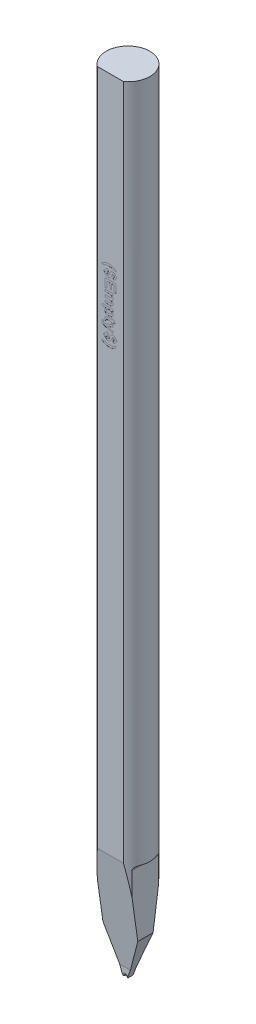
from build123d import *

# Parameters (mm, degrees)
SKETCH_TL_CUTTING_R       = 1.99771
TL_CUTTING_DEPTH          = 72.009
SKETCH_TDF_GRINDING_W     = 4.01542
SKETCH_TDF_GRINDING_H     = 4.01542
TDF_GRINDING_DEPTH        = 73.064400167
ENGRAVING_DEPTH           = 0.005
VW_VR_GRINDING_DEPTH      = 2.00771
VW_VR_GRINDING_DEPTH_BACK = 2.00771
ISA_GRINDING_DEPTH        = 2.00771
ISA_GRINDING_DEPTH_BACK   = 2.00771
PRE_FRX_BRX_DEPTH         = 2.00771
PRE_FRX_BRX_DEPTH_BACK    = 2.00771
SKETCH_PRE_FRX_BRX_W      = 1.7372
SKETCH_PRE_FRX_BRX_H      = 0.78994
FR_EDM_R                  = 0.20066
BR_EDM_R                  = 0.09906
FA_BA_GRINDING_DEPTH      = 2.00771
FA_BA_GRINDING_DEPTH_BACK = 2.00771


with BuildPart() as part:
    # sketch_TL_cutting → TL_cutting (new body)
    with BuildSketch(Plane(origin=(0, 0, 0), x_dir=(1, 0, 0), z_dir=(0, 1, 0))):
        with Locations(Location((0, 0, 0), (0, 0, 270))):
            Circle(SKETCH_TL_CUTTING_R)
    extrude(amount=TL_CUTTING_DEPTH)

    # sketch_TDF_grinding → TDF_grinding (cut, through all)
    with BuildSketch(Plane(origin=(0, 0, 0), x_dir=(1, 0, 0), z_dir=(0, 1, 0))):
        with Locations((0, -3.60918)):
            Rectangle(SKETCH_TDF_GRINDING_W, SKETCH_TDF_GRINDING_H)
    extrude(amount=TDF_GRINDING_DEPTH, mode=Mode.SUBTRACT)

    # sketch_engraving → engraving (cut)
    # profile 1 of 9: a face of its own
    with BuildSketch(Plane.XY.offset(1.60147)):
        with BuildLine():
            Line((-0.769230769, 56.611564103), (-0.769230769, 56.726948718))
            add(Edge.make_bspline(
                [(-0.769230769, 56.726948718), (-0.75654381, 56.735663826), (-0.731271202, 56.75302445), (-0.692407522, 56.777108744), (-0.653253405, 56.799807931), (-0.61390654, 56.821057444), (-0.574088198, 56.840594152), (-0.533834647, 56.85827299), (-0.493399806, 56.874882514), (-0.452559629, 56.889379278), (-0.411730957, 56.902372472), (-0.37117072, 56.913933672), (-0.330720232, 56.923167297), (-0.290776237, 56.931412038), (-0.251027852, 56.937272807), (-0.211754164, 56.941765375), (-0.172781576, 56.944468765), (-0.146905785, 56.944754889), (-0.134014423, 56.944897436)],
                knots=[0, 0, 0, 0, 1.083507766, 2.158363427, 3.217863588, 4.26952313, 5.306027247, 6.339424422, 7.364296331, 8.382863073, 9.389381803, 10.380601174, 11.351000725, 12.30983044, 13.25126181, 14.178453692, 15.092502614, 16, 16, 16, 16], degree=3))
            add(Edge.make_bspline(
                [(-0.134014423, 56.944897436), (-0.118183889, 56.944720886), (-0.086756823, 56.944370396), (-0.039956705, 56.941072127), (0.006211299, 56.935593151), (0.051774559, 56.928331702), (0.096653064, 56.918551161), (0.140935004, 56.90698945), (0.184649405, 56.893283306), (0.2131297, 56.882285182), (0.227363782, 56.876788462)],
                knots=[0, 0, 0, 0, 1.026825403, 2.038472649, 3.041589395, 4.042121555, 5.030199178, 6.019908545, 7.010375948, 8, 8, 8, 8], degree=3))
            add(Edge.make_bspline(
                [(0.227363782, 56.876788462), (0.251683724, 56.86662748), (0.300012726, 56.846435406), (0.369571494, 56.810574678), (0.43660795, 56.771337941), (0.478889333, 56.74173111), (0.5, 56.726948718)],
                knots=[0, 0, 0, 0, 1.013799707, 2.014640032, 3.00872983, 4, 4, 4, 4], degree=3))
            Line((0.5, 56.726948718), (0.5, 56.611564103))
            add(Edge.make_bspline(
                [(0.5, 56.611564103), (0.483671183, 56.618120598), (0.451734259, 56.630944202), (0.404403907, 56.648404634), (0.359131946, 56.664765299), (0.315658143, 56.679413628), (0.273946214, 56.69238068), (0.234213299, 56.70413527), (0.196217088, 56.713881677), (0.148045143, 56.725244778), (0.087918925, 56.736328711), (0.014547585, 56.745586625), (-0.060927268, 56.751701265), (-0.111967077, 56.752291015), (-0.137820513, 56.752589744)],
                knots=[0, 0, 0, 0, 0.962863393, 1.883228553, 2.76049045, 3.597092273, 4.393389301, 5.150807945, 5.864262675, 6.539665604, 7.859093728, 9.207470704, 10.585486956, 12, 12, 12, 12], degree=3))
            add(Edge.make_bspline(
                [(-0.137820513, 56.752589744), (-0.155988322, 56.752343487), (-0.192554908, 56.751847842), (-0.247746387, 56.748261408), (-0.303631191, 56.742771672), (-0.359778417, 56.734616456), (-0.415599441, 56.724983778), (-0.470281715, 56.713252997), (-0.523675907, 56.700229417), (-0.558467126, 56.689835667), (-0.575721154, 56.68468109)],
                knots=[0, 0, 0, 0, 0.980476084, 1.97341699, 2.983932057, 4.010380506, 5.034783484, 6.040583597, 7.02826557, 8, 8, 8, 8], degree=3))
            add(Edge.make_bspline(
                [(-0.575721154, 56.68468109), (-0.581680072, 56.682859776), (-0.594203733, 56.679031979), (-0.613643056, 56.671976075), (-0.635084462, 56.664505083), (-0.658352199, 56.655786341), (-0.683499135, 56.646272512), (-0.710430496, 56.635536673), (-0.739235975, 56.623981317), (-0.7590223, 56.615790194), (-0.769230769, 56.611564103)],
                knots=[0, 0, 0, 0, 0.722569934, 1.518601428, 2.397973139, 3.356076064, 4.400297102, 5.516290093, 6.718565658, 8, 8, 8, 8], degree=3))
        make_face()
    # profile 2 of 9: a face of its own
    with BuildSketch(Plane.XY.offset(1.60147)):
        with BuildLine():
            Line((-0.346153846, 56.226948718), (-0.063902244, 56.226948718))
            add(Edge.make_bspline(
                [(-0.063902244, 56.226948718), (-0.060691422, 56.237143266), (-0.054417647, 56.257062868), (-0.043102981, 56.285435864), (-0.03104034, 56.311894737), (-0.017255553, 56.335922913), (-0.002706808, 56.358195401), (0.013349437, 56.378160446), (0.030392388, 56.396185381), (0.048816212, 56.411900426), (0.068263793, 56.425644345), (0.088567069, 56.437911105), (0.110125164, 56.447723618), (0.132438861, 56.456389102), (0.155973296, 56.462652823), (0.180398952, 56.467325467), (0.205875491, 56.469883399), (0.223151848, 56.470317076), (0.231971154, 56.470538462)],
                knots=[0, 0, 0, 0, 1.233471439, 2.410137288, 3.52407584, 4.58730311, 5.604983541, 6.592165279, 7.540854934, 8.464761394, 9.382375568, 10.287963167, 11.198393515, 12.113251355, 13.048281916, 14.005296989, 14.981735836, 16, 16, 16, 16], degree=3))
            add(Edge.make_bspline(
                [(0.231971154, 56.470538462), (0.240862374, 56.470369834), (0.258371063, 56.47003777), (0.284035262, 56.466710465), (0.308630388, 56.461512705), (0.332214124, 56.454327878), (0.354666156, 56.444872426), (0.375999861, 56.433410852), (0.396225213, 56.419891645), (0.415061575, 56.404246572), (0.432812136, 56.387237259), (0.448139285, 56.36818408), (0.461933462, 56.348127842), (0.473588781, 56.326562978), (0.483166571, 56.303572929), (0.491049568, 56.279359162), (0.496663149, 56.253639945), (0.49887037, 56.235984548), (0.5, 56.226948718)],
                knots=[0, 0, 0, 0, 1.065419917, 2.098036635, 3.096580821, 4.076501369, 5.04880669, 6.012240184, 6.975806694, 7.959773282, 8.944748783, 9.917449457, 10.885494533, 11.859775015, 12.849941464, 13.867618658, 14.908671599, 16, 16, 16, 16], degree=3))
            Line((0.5, 56.226948718), (0.576923077, 56.226948718))
            Line((0.576923077, 56.226948718), (0.576923077, 56.124384615))
            Line((0.576923077, 56.124384615), (0.5, 56.124384615))
            add(Edge.make_bspline(
                [(0.5, 56.124384615), (0.498841424, 56.115486686), (0.496573389, 56.09806805), (0.49137632, 56.072741064), (0.484539762, 56.048860422), (0.476339583, 56.026349842), (0.466697028, 56.005143702), (0.455518194, 55.985361964), (0.442840864, 55.966933141), (0.428527318, 55.95018479), (0.413145824, 55.934584638), (0.39610941, 55.920827789), (0.378155721, 55.908112331), (0.358829355, 55.897061433), (0.338178987, 55.887674614), (0.316411919, 55.87941047), (0.293274546, 55.872799442), (0.27733531, 55.869600771), (0.269230769, 55.867974359)],
                knots=[0, 0, 0, 0, 1.151887312, 2.254940947, 3.31604567, 4.338626222, 5.328478017, 6.30366564, 7.252607131, 8.195603958, 9.129238937, 10.061258459, 11.003163313, 11.951756149, 12.914654824, 13.913120779, 14.938895277, 16, 16, 16, 16], degree=3))
            Line((0.269230769, 55.867974359), (0.243589744, 56.034641026))
            add(Edge.make_bspline(
                [(0.243589744, 56.034641026), (0.250446456, 56.036643558), (0.263771485, 56.040535192), (0.282535036, 56.048465441), (0.299671316, 56.057678859), (0.315110354, 56.068227628), (0.328747964, 56.080224188), (0.340615646, 56.09355588), (0.351026936, 56.108191319), (0.356312409, 56.118960751), (0.358974359, 56.124384615)],
                knots=[0, 0, 0, 0, 1.132612369, 2.201068414, 3.225051706, 4.215432487, 5.161289188, 6.099220658, 7.04270083, 8, 8, 8, 8], degree=3))
            Line((0.358974359, 56.124384615), (0.095552885, 56.124384615))
            add(Edge.make_bspline(
                [(0.095552885, 56.124384615), (0.091846888, 56.111134392), (0.084711092, 56.085621445), (0.072793936, 56.049230821), (0.059721416, 56.016296736), (0.046029912, 55.986577051), (0.031359337, 55.960199095), (0.016057305, 55.936950063), (-0.000406851, 55.917264806), (-0.017692985, 55.90057685), (-0.036309981, 55.887032312), (-0.055531671, 55.874731893), (-0.076319964, 55.864821076), (-0.098285192, 55.856514134), (-0.121510852, 55.850207549), (-0.145938277, 55.845497559), (-0.171622588, 55.842996815), (-0.189164574, 55.842557523), (-0.198116987, 55.842333333)],
                knots=[0, 0, 0, 0, 1.47567488, 2.841372022, 4.104837161, 5.274356171, 6.348422789, 7.339634063, 8.254806618, 9.095728451, 9.909336987, 10.720135121, 11.540149133, 12.374211184, 13.236039526, 14.118162803, 15.039619326, 16, 16, 16, 16], degree=3))
            add(Edge.make_bspline(
                [(-0.198116987, 55.842333333), (-0.208142, 55.842575379), (-0.227850116, 55.843051216), (-0.256821167, 55.846471811), (-0.284551423, 55.852320659), (-0.311143037, 55.860302461), (-0.336478096, 55.870703856), (-0.360449465, 55.883721867), (-0.383339011, 55.898751156), (-0.405018236, 55.915957227), (-0.425053345, 55.935437905), (-0.443316442, 55.956889482), (-0.459578741, 55.980293772), (-0.474036034, 56.005432354), (-0.486703174, 56.032431862), (-0.497491454, 56.061298177), (-0.506369109, 56.092117722), (-0.510637243, 56.113464927), (-0.512820513, 56.124384615)],
                knots=[0, 0, 0, 0, 1.03830894, 2.041205585, 3.016534218, 3.970513834, 4.913295289, 5.847846025, 6.791667113, 7.746548932, 8.710133323, 9.681653264, 10.66021374, 11.657945465, 12.682082278, 13.745789509, 14.84690868, 16, 16, 16, 16], degree=3))
            Line((-0.512820513, 56.124384615), (-0.641025641, 56.124384615))
            Line((-0.641025641, 56.124384615), (-0.641025641, 56.226948718))
            Line((-0.641025641, 56.226948718), (-0.512820513, 56.226948718))
            add(Edge.make_bspline(
                [(-0.512820513, 56.226948718), (-0.511365569, 56.235993376), (-0.508497729, 56.253821301), (-0.501708114, 56.279680106), (-0.493672179, 56.304444222), (-0.483362821, 56.327734513), (-0.471282985, 56.349710338), (-0.457442831, 56.370330001), (-0.441914521, 56.389778959), (-0.424444795, 56.407782199), (-0.405185733, 56.424467381), (-0.384010208, 56.4395823), (-0.360904849, 56.452986013), (-0.335919458, 56.464741317), (-0.309230571, 56.475320078), (-0.280464835, 56.483703551), (-0.249946988, 56.491100501), (-0.228795072, 56.494457879), (-0.217948718, 56.496179487)],
                knots=[0, 0, 0, 0, 1.014565868, 1.999810643, 2.959153021, 3.896762473, 4.817401281, 5.734733625, 6.645326844, 7.571538865, 8.510548692, 9.465314575, 10.450114695, 11.466190414, 12.522838407, 13.627737783, 14.783543095, 16, 16, 16, 16], degree=3))
            Line((-0.217948718, 56.496179487), (-0.192307692, 56.329512821))
            add(Edge.make_bspline(
                [(-0.192307692, 56.329512821), (-0.201304383, 56.327560775), (-0.218871734, 56.323749123), (-0.243936875, 56.315017324), (-0.267070938, 56.304026951), (-0.287973212, 56.290797737), (-0.306574231, 56.276291657), (-0.322506138, 56.260740348), (-0.336055086, 56.244580368), (-0.342841228, 56.232732292), (-0.346153846, 56.226948718)],
                knots=[0, 0, 0, 0, 1.156277083, 2.257799727, 3.327693098, 4.368586128, 5.360870913, 6.286760294, 7.163691387, 8, 8, 8, 8], degree=3))
        make_face()
        with BuildLine():
            add(Edge.make_bspline(
                [(0.358974359, 56.226948718), (0.356717333, 56.232992086), (0.352323078, 56.244758059), (0.342207363, 56.260507034), (0.329671684, 56.273923048), (0.314627801, 56.284702628), (0.298154817, 56.293142912), (0.280699719, 56.299552483), (0.262303768, 56.303185993), (0.249748228, 56.303641235), (0.243389423, 56.303871795)],
                knots=[0, 0, 0, 0, 1.038261919, 2.021415961, 2.996868165, 3.983674221, 4.990617688, 5.975363788, 6.97461459, 8, 8, 8, 8], degree=3))
            add(Edge.make_bspline(
                [(0.243389423, 56.303871795), (0.23756032, 56.303721402), (0.225998475, 56.303423102), (0.209074665, 56.29974233), (0.192634157, 56.29441819), (0.177010257, 56.286573685), (0.16226258, 56.276278866), (0.149112783, 56.262726829), (0.137430451, 56.24612493), (0.131236645, 56.233523802), (0.128004808, 56.226948718)],
                knots=[0, 0, 0, 0, 0.946787839, 1.877924175, 2.805567745, 3.753041052, 4.711661487, 5.718097864, 6.809336945, 8, 8, 8, 8], degree=3))
            Line((0.128004808, 56.226948718), (0.358974359, 56.226948718))
        make_face(mode=Mode.SUBTRACT)
        with BuildLine():
            add(Edge.make_bspline(
                [(-0.346153846, 56.124384615), (-0.345705345, 56.116185175), (-0.34483103, 56.100201084), (-0.337601638, 56.077493624), (-0.325657788, 56.057310262), (-0.309263795, 56.040179958), (-0.289891882, 56.026342959), (-0.268342869, 56.016345675), (-0.24520997, 56.010077578), (-0.229139944, 56.009363677), (-0.220953526, 56.009)],
                knots=[0, 0, 0, 0, 1.03495557, 2.017555319, 2.978963058, 3.976357979, 4.993109917, 5.971347703, 6.966560647, 8, 8, 8, 8], degree=3))
            add(Edge.make_bspline(
                [(-0.220953526, 56.009), (-0.213643973, 56.009272343), (-0.199375663, 56.00980396), (-0.178751062, 56.015029744), (-0.159765904, 56.023484931), (-0.142238273, 56.03538561), (-0.126537208, 56.051348938), (-0.113258624, 56.071844849), (-0.101443075, 56.096373029), (-0.09589405, 56.114671881), (-0.092948718, 56.124384615)],
                knots=[0, 0, 0, 0, 0.934982296, 1.825093612, 2.705865091, 3.586179448, 4.523819282, 5.553563867, 6.701471314, 8, 8, 8, 8], degree=3))
            Line((-0.092948718, 56.124384615), (-0.346153846, 56.124384615))
        make_face(mode=Mode.SUBTRACT)
    # profile 3 of 9: a face of its own
    with BuildSketch(Plane.XY.offset(1.60147)):
        Polygon((-0.5, 55.675666667), (0.5, 55.675666667), (0.5, 54.932076923), (0.333333333, 54.932076923), (0.333333333, 55.483358974), (0.115384615, 55.483358974), (0.115384615, 54.970538462), (-0.051282051, 54.970538462), (-0.051282051, 55.483358974), (-0.333333333, 55.483358974), (-0.333333333, 54.91925641), (-0.5, 54.91925641), align=None)
    # profile 4 of 9: a face of its own
    with BuildSketch(Plane.XY.offset(1.60147)):
        with BuildLine():
            Line((0.230769231, 54.778230769), (0.230769231, 54.585923077))
            Line((0.230769231, 54.585923077), (0.1328125, 54.585923077))
            add(Edge.make_bspline(
                [(0.1328125, 54.585923077), (0.141664699, 54.578359049), (0.158931351, 54.563605038), (0.181382685, 54.538923789), (0.200586186, 54.513416739), (0.21644089, 54.486832809), (0.228531159, 54.458934117), (0.237134296, 54.429946875), (0.242539521, 54.399891949), (0.243237377, 54.379481895), (0.243589744, 54.369176282)],
                knots=[0, 0, 0, 0, 1.107940857, 2.161093632, 3.169644562, 4.144639019, 5.101548547, 6.057210626, 7.019030711, 8, 8, 8, 8], degree=3))
            add(Edge.make_bspline(
                [(0.243589744, 54.369176282), (0.243215794, 54.358410033), (0.242486901, 54.337424744), (0.237632212, 54.306967189), (0.228624904, 54.278890488), (0.216596826, 54.25293503), (0.200997643, 54.229186923), (0.181697421, 54.207803483), (0.1589088, 54.188570942), (0.141647297, 54.178047815), (0.1328125, 54.172661859)],
                knots=[0, 0, 0, 0, 1.087442074, 2.119613481, 3.102840357, 4.056171906, 5.000733146, 5.960649063, 6.95621775, 8, 8, 8, 8], degree=3))
            add(Edge.make_bspline(
                [(0.1328125, 54.172661859), (0.141648331, 54.164741809), (0.15890459, 54.149274061), (0.18160607, 54.123912536), (0.200837622, 54.097588586), (0.216342266, 54.070185607), (0.228440547, 54.041886572), (0.237463475, 54.012736515), (0.242455792, 53.982395313), (0.243209151, 53.961874823), (0.243589744, 53.951508013)],
                knots=[0, 0, 0, 0, 1.113355786, 2.174368662, 3.188819075, 4.168565139, 5.12342631, 6.073356391, 7.026672896, 8, 8, 8, 8], degree=3))
            add(Edge.make_bspline(
                [(0.243589744, 53.951508013), (0.243253707, 53.938725949), (0.242603687, 53.914000698), (0.236233833, 53.878451934), (0.226092646, 53.845846208), (0.211825029, 53.816371427), (0.193628332, 53.79007465), (0.171312748, 53.767536921), (0.145297956, 53.748199279), (0.125650654, 53.738783721), (0.115584936, 53.733959936)],
                knots=[0, 0, 0, 0, 1.140905914, 2.206935121, 3.214358517, 4.182792527, 5.121068659, 6.057503675, 7.004819049, 8, 8, 8, 8], degree=3))
            add(Edge.make_bspline(
                [(0.115584936, 53.733959936), (0.1114006, 53.732358143), (0.102614163, 53.728994633), (0.088193677, 53.7250406), (0.07205936, 53.721717836), (0.05407705, 53.718900231), (0.034354022, 53.716783997), (0.012779717, 53.715109993), (-0.010546601, 53.714459858), (-0.026709385, 53.714241149), (-0.03505609, 53.714128205)],
                knots=[0, 0, 0, 0, 0.70348757, 1.477211565, 2.345356006, 3.290383569, 4.335215205, 5.460703428, 6.68866909, 8, 8, 8, 8], degree=3))
            Line((-0.03505609, 53.714128205), (-0.5, 53.714128205))
            Line((-0.5, 53.714128205), (-0.5, 53.906435897))
            Line((-0.5, 53.906435897), (-0.080128205, 53.906435897))
            add(Edge.make_bspline(
                [(-0.080128205, 53.906435897), (-0.07144761, 53.906547935), (-0.054817384, 53.906762576), (-0.031090468, 53.907406731), (-0.009777274, 53.909044643), (0.009076857, 53.911186366), (0.025551617, 53.91391905), (0.039613136, 53.917295096), (0.051411557, 53.921089266), (0.058064109, 53.924645803), (0.061097756, 53.926267628)],
                knots=[0, 0, 0, 0, 1.448583407, 2.775186282, 3.959557885, 5.014017743, 5.940851432, 6.743435621, 7.42699079, 8, 8, 8, 8], degree=3))
            add(Edge.make_bspline(
                [(0.061097756, 53.926267628), (0.0644449, 53.928508242), (0.071015994, 53.932907002), (0.079428524, 53.94104351), (0.086594396, 53.949987573), (0.092366124, 53.959872082), (0.097066603, 53.970530677), (0.100204228, 53.982148841), (0.10230955, 53.994633517), (0.102477414, 54.003314837), (0.102564103, 54.007798077)],
                knots=[0, 0, 0, 0, 1.007330723, 1.977586358, 2.91811154, 3.870610884, 4.837109745, 5.827490497, 6.87806446, 8, 8, 8, 8], degree=3))
            add(Edge.make_bspline(
                [(0.102564103, 54.007798077), (0.102240034, 54.01443365), (0.101593875, 54.027664313), (0.09685111, 54.047122239), (0.088810593, 54.065848966), (0.077873982, 54.083699946), (0.064089543, 54.100338814), (0.046951113, 54.114414723), (0.027058253, 54.126184107), (0.008201325, 54.133566057), (-0.008714124, 54.138275058), (-0.023370098, 54.141428886), (-0.039736185, 54.144230026), (-0.057919723, 54.146426211), (-0.07777632, 54.14791842), (-0.09941442, 54.149127695), (-0.122723067, 54.149973668), (-0.138888099, 54.150007942), (-0.147235577, 54.150025641)],
                knots=[0, 0, 0, 0, 0.980909897, 1.955835539, 2.942693402, 3.98436442, 5.042755257, 6.12263035, 7.247279534, 8.448501813, 9.105087946, 9.843148781, 10.66469806, 11.560151265, 12.550905382, 13.609296218, 14.765461946, 16, 16, 16, 16], degree=3))
            Line((-0.147235577, 54.150025641), (-0.5, 54.150025641))
            Line((-0.5, 54.150025641), (-0.5, 54.342333333))
            Line((-0.5, 54.342333333), (-0.097355769, 54.342333333))
            add(Edge.make_bspline(
                [(-0.097355769, 54.342333333), (-0.088808683, 54.342387673), (-0.072514885, 54.342491264), (-0.049272866, 54.342832415), (-0.028431625, 54.343598963), (-0.010001412, 54.344816338), (0.006094573, 54.346219335), (0.019817647, 54.347693711), (0.031211059, 54.3496468), (0.042972639, 54.352762901), (0.055281064, 54.357674574), (0.068015353, 54.364905367), (0.078952496, 54.37337508), (0.087734398, 54.383592499), (0.094431133, 54.39552783), (0.099289836, 54.409190268), (0.101996826, 54.424759663), (0.102369061, 54.435739069), (0.102564103, 54.441491987)],
                knots=[0, 0, 0, 0, 1.59941463, 3.049055322, 4.349500855, 5.501487129, 6.504910079, 7.372843676, 8.083634967, 8.665560774, 9.647038445, 10.55368294, 11.398647399, 12.222657519, 13.056461931, 13.945719492, 14.92361148, 16, 16, 16, 16], degree=3))
            add(Edge.make_bspline(
                [(0.102564103, 54.441491987), (0.102234348, 54.448658367), (0.101586917, 54.462728621), (0.097099356, 54.483322194), (0.089385598, 54.502697199), (0.078745529, 54.520760574), (0.065308531, 54.537164364), (0.048811546, 54.551063128), (0.02977557, 54.562600394), (0.011740073, 54.569890429), (-0.004479026, 54.57462018), (-0.018770373, 54.57751101), (-0.034874654, 54.580111233), (-0.052844538, 54.58232052), (-0.072766981, 54.583839446), (-0.094540599, 54.585014918), (-0.118182385, 54.585875318), (-0.134547779, 54.585906775), (-0.143028846, 54.585923077)],
                knots=[0, 0, 0, 0, 1.061105177, 2.08334182, 3.104381884, 4.137278018, 5.176827868, 6.229094397, 7.316239487, 8.460364206, 9.09881589, 9.816452537, 10.617971519, 11.514628853, 12.496857794, 13.576419947, 14.74402393, 16, 16, 16, 16], degree=3))
            Line((-0.143028846, 54.585923077), (-0.5, 54.585923077))
            Line((-0.5, 54.585923077), (-0.5, 54.778230769))
            Line((-0.5, 54.778230769), (0.230769231, 54.778230769))
        make_face()
    # profile 5 of 9: a face of its own
    with BuildSketch(Plane.XY.offset(1.60147)):
        with BuildLine():
            Line((0.230769231, 53.521820513), (0.230769231, 53.329512821))
            Line((0.230769231, 53.329512821), (0.125400641, 53.329512821))
            add(Edge.make_bspline(
                [(0.125400641, 53.329512821), (0.134110558, 53.323789731), (0.151482958, 53.312374718), (0.174623276, 53.291319889), (0.194727471, 53.267179744), (0.21216262, 53.240640955), (0.226252501, 53.211806915), (0.236247247, 53.181133514), (0.242498657, 53.148943396), (0.243222023, 53.126950728), (0.243589744, 53.115770833)],
                knots=[0, 0, 0, 0, 0.978547196, 1.95176541, 2.927409496, 3.924956672, 4.929940552, 5.934297003, 6.949907262, 8, 8, 8, 8], degree=3))
            add(Edge.make_bspline(
                [(0.243589744, 53.115770833), (0.243275199, 53.106003359), (0.242653327, 53.086692556), (0.237904657, 53.058336182), (0.230300531, 53.031019066), (0.219424348, 53.00483804), (0.205256392, 52.979900966), (0.188112758, 52.956138662), (0.167850875, 52.933577666), (0.144791975, 52.912281795), (0.118886648, 52.892784547), (0.090438984, 52.875746955), (0.059420431, 52.861512172), (0.02614289, 52.849614093), (-0.00973483, 52.840790018), (-0.047865347, 52.834089032), (-0.088468702, 52.830383122), (-0.116312431, 52.82980808), (-0.130608974, 52.829512821)],
                knots=[0, 0, 0, 0, 0.889183518, 1.757962001, 2.610823862, 3.466866804, 4.332788647, 5.217155532, 6.130223362, 7.089913047, 8.071415563, 9.077827182, 10.103546864, 11.174887114, 12.291391641, 13.464112916, 14.69793237, 16, 16, 16, 16], degree=3))
            add(Edge.make_bspline(
                [(-0.130608974, 52.829512821), (-0.145309675, 52.829777446), (-0.173899782, 52.830292094), (-0.215458383, 52.834402127), (-0.254585771, 52.840776506), (-0.291083626, 52.85058219), (-0.325347568, 52.862394954), (-0.356921697, 52.877327394), (-0.386073852, 52.894801106), (-0.412336985, 52.915059239), (-0.435948519, 52.936992733), (-0.456547424, 52.960307103), (-0.473866574, 52.984832979), (-0.488041441, 53.010500814), (-0.499108447, 53.03731691), (-0.507216556, 53.065229904), (-0.511869709, 53.094380749), (-0.512500462, 53.114152095), (-0.512820513, 53.124184295)],
                knots=[0, 0, 0, 0, 1.306276956, 2.54046374, 3.708317787, 4.825351227, 5.895229917, 6.925275359, 7.923721025, 8.910100439, 9.867470588, 10.784172372, 11.670002506, 12.530604141, 13.384735846, 14.243124713, 15.108541968, 16, 16, 16, 16], degree=3))
            add(Edge.make_bspline(
                [(-0.512820513, 53.124184295), (-0.512609167, 53.133690186), (-0.512194245, 53.152352468), (-0.507198627, 53.179557904), (-0.500287281, 53.205588151), (-0.489449809, 53.230441328), (-0.475076841, 53.254817244), (-0.456848814, 53.279593251), (-0.434276455, 53.304830916), (-0.417064851, 53.321030662), (-0.408052885, 53.329512821)],
                knots=[0, 0, 0, 0, 0.955822701, 1.876503125, 2.776905967, 3.662325514, 4.596312032, 5.620965962, 6.754341905, 8, 8, 8, 8], degree=3))
            Line((-0.408052885, 53.329512821), (-0.769230769, 53.329512821))
            Line((-0.769230769, 53.329512821), (-0.769230769, 53.521820513))
            Line((-0.769230769, 53.521820513), (0.230769231, 53.521820513))
        make_face()
        with BuildLine():
            add(Edge.make_bspline(
                [(-0.122195513, 53.329512821), (-0.132481435, 53.329330938), (-0.152405274, 53.328978631), (-0.181244648, 53.327077339), (-0.208037309, 53.323546885), (-0.232684253, 53.318235747), (-0.255441334, 53.312050174), (-0.275988928, 53.303930804), (-0.294539024, 53.294622167), (-0.310824186, 53.283698167), (-0.325130191, 53.271818833), (-0.337524496, 53.259247515), (-0.348144327, 53.246075436), (-0.356821345, 53.23224956), (-0.363446941, 53.217669312), (-0.368372821, 53.202507368), (-0.371163803, 53.186653237), (-0.371583715, 53.175877184), (-0.371794872, 53.170458333)],
                knots=[0, 0, 0, 0, 1.493314022, 2.892550594, 4.193549699, 5.412205958, 6.550654332, 7.612709232, 8.614154521, 9.557822924, 10.452682187, 11.309508678, 12.116407821, 12.904513946, 13.672267114, 14.435601522, 15.213325928, 16, 16, 16, 16], degree=3))
            add(Edge.make_bspline(
                [(-0.371794872, 53.170458333), (-0.371659076, 53.165238996), (-0.371390934, 53.154932918), (-0.368717534, 53.139850329), (-0.36428733, 53.1254401), (-0.35796517, 53.111782234), (-0.350180339, 53.098647389), (-0.340400371, 53.086335676), (-0.328879204, 53.074787269), (-0.315890023, 53.063521873), (-0.300495775, 53.053808804), (-0.283066961, 53.045116707), (-0.26342759, 53.037702345), (-0.241425455, 53.032059812), (-0.21727146, 53.027453704), (-0.190916328, 53.02410908), (-0.162291664, 53.022084026), (-0.142498204, 53.021910628), (-0.132211538, 53.021820513)],
                knots=[0, 0, 0, 0, 0.791436533, 1.562766886, 2.315979036, 3.073269983, 3.841398674, 4.627954771, 5.451998839, 6.314818792, 7.231140921, 8.205467689, 9.266952699, 10.409907015, 11.648037837, 12.996681567, 14.439174734, 16, 16, 16, 16], degree=3))
            add(Edge.make_bspline(
                [(-0.132211538, 53.021820513), (-0.122590159, 53.021885744), (-0.103987384, 53.022011868), (-0.077055352, 53.024396462), (-0.051997139, 53.027603604), (-0.028873936, 53.032518131), (-0.007518455, 53.038306551), (0.01172948, 53.046020618), (0.029199081, 53.054792491), (0.044606747, 53.065096056), (0.058319539, 53.076225976), (0.069887203, 53.088411635), (0.080128065, 53.10083484), (0.08840061, 53.11408001), (0.094621072, 53.128151434), (0.099305551, 53.142696751), (0.101912651, 53.158013515), (0.102344136, 53.168379172), (0.102564103, 53.173663462)],
                knots=[0, 0, 0, 0, 1.476459806, 2.854710082, 4.147877, 5.352136794, 6.481419541, 7.539804139, 8.530071065, 9.476830027, 10.379846701, 11.23529603, 12.051777807, 12.848258948, 13.623682229, 14.408266492, 15.188553102, 16, 16, 16, 16], degree=3))
            add(Edge.make_bspline(
                [(0.102564103, 53.173663462), (0.102455308, 53.179153683), (0.102241498, 53.189943463), (0.099201363, 53.205705699), (0.094853437, 53.220854844), (0.088686029, 53.235317083), (0.080452533, 53.248825762), (0.070807323, 53.261847745), (0.059117992, 53.273947129), (0.045859614, 53.285459774), (0.030812699, 53.295916203), (0.01390315, 53.304896172), (-0.00466452, 53.312440447), (-0.024767533, 53.318971117), (-0.046730612, 53.323669687), (-0.070369893, 53.326944967), (-0.095705859, 53.329315572), (-0.113175154, 53.329445653), (-0.122195513, 53.329512821)],
                knots=[0, 0, 0, 0, 0.85812159, 1.686442648, 2.503408574, 3.322778131, 4.138405645, 4.97460315, 5.854412976, 6.765937777, 7.719865152, 8.715925653, 9.756353289, 10.85381274, 12.020422519, 13.266547949, 14.588568337, 16, 16, 16, 16], degree=3))
        make_face(mode=Mode.SUBTRACT)
    # profile 6 of 9: a face of its own
    with BuildSketch(Plane.XY.offset(1.60147)):
        with BuildLine():
            Line((0.230769231, 52.329512821), (0.08974359, 52.329512821))
            Line((0.08974359, 52.329512821), (0.08974359, 52.470538462))
            Line((0.08974359, 52.470538462), (-0.224358974, 52.470538462))
            add(Edge.make_bspline(
                [(-0.224358974, 52.470538462), (-0.231904339, 52.47055171), (-0.246127351, 52.470576684), (-0.266228543, 52.470412391), (-0.283853768, 52.469932133), (-0.299018236, 52.469649783), (-0.311701045, 52.46897022), (-0.321861303, 52.468462927), (-0.329566697, 52.467740323), (-0.338907815, 52.466012609), (-0.35057578, 52.46098511), (-0.360389431, 52.451317637), (-0.366182432, 52.44179528), (-0.369474906, 52.433766405), (-0.371514578, 52.424967167), (-0.371700117, 52.418800144), (-0.371794872, 52.415650641)],
                knots=[0, 0, 0, 0, 1.773599637, 3.343235314, 4.724802322, 5.918078765, 6.908020279, 7.709878159, 8.309605123, 8.725167438, 9.94114383, 11.228754835, 11.890951744, 12.552590386, 13.260806876, 14, 14, 14, 14], degree=3))
            add(Edge.make_bspline(
                [(-0.371794872, 52.415650641), (-0.371507964, 52.410495649), (-0.37087716, 52.399161728), (-0.367095421, 52.380687003), (-0.361305779, 52.35922894), (-0.356131124, 52.344040802), (-0.353365385, 52.335923077)],
                knots=[0, 0, 0, 0, 0.75345353, 1.656565626, 2.747486109, 4, 4, 4, 4], degree=3))
            Line((-0.353365385, 52.335923077), (-0.487379808, 52.316692308))
            add(Edge.make_bspline(
                [(-0.487379808, 52.316692308), (-0.491390152, 52.328369641), (-0.499569528, 52.352186373), (-0.506906498, 52.3900411), (-0.512003384, 52.42993354), (-0.512543433, 52.457299316), (-0.512820513, 52.471339744)],
                knots=[0, 0, 0, 0, 0.939563481, 1.916305015, 2.930928536, 4, 4, 4, 4], degree=3))
            add(Edge.make_bspline(
                [(-0.512820513, 52.471339744), (-0.512564303, 52.479962381), (-0.512063975, 52.49680071), (-0.50889268, 52.521457549), (-0.50326966, 52.544746429), (-0.495519476, 52.566499989), (-0.485995694, 52.586145599), (-0.475305475, 52.603448436), (-0.462868601, 52.617641671), (-0.449141562, 52.629497462), (-0.433202705, 52.638848766), (-0.415065056, 52.646272715), (-0.394648734, 52.652652966), (-0.380046946, 52.655266675), (-0.372395833, 52.656636218)],
                knots=[0, 0, 0, 0, 1.203015215, 2.349253984, 3.460901624, 4.539344044, 5.564274864, 6.502382232, 7.367332183, 8.186789841, 9.022345106, 9.932420497, 10.916620053, 12, 12, 12, 12], degree=3))
            add(Edge.make_bspline(
                [(-0.372395833, 52.656636218), (-0.369192653, 52.657116428), (-0.362066116, 52.658184813), (-0.35025766, 52.659634383), (-0.336212257, 52.660528825), (-0.319980191, 52.661261789), (-0.301558032, 52.662201997), (-0.280981809, 52.662400781), (-0.258215711, 52.66297611), (-0.242321525, 52.662890903), (-0.233974359, 52.662846154)],
                knots=[0, 0, 0, 0, 0.560521704, 1.24706641, 2.057998689, 2.995119087, 4.059211621, 5.249632546, 6.555586685, 8, 8, 8, 8], degree=3))
            Line((-0.233974359, 52.662846154), (0.08974359, 52.662846154))
            Line((0.08974359, 52.662846154), (0.08974359, 52.752589744))
            Line((0.08974359, 52.752589744), (0.230769231, 52.752589744))
            Line((0.230769231, 52.752589744), (0.230769231, 52.662846154))
            Line((0.230769231, 52.662846154), (0.371794872, 52.662846154))
            Line((0.371794872, 52.662846154), (0.487179487, 52.470538462))
            Line((0.487179487, 52.470538462), (0.230769231, 52.470538462))
            Line((0.230769231, 52.470538462), (0.230769231, 52.329512821))
        make_face()
    # profile 7 of 9: a face of its own
    with BuildSketch(Plane.XY.offset(1.60147)):
        with BuildLine():
            Line((0.230769231, 52.303871795), (0.230769231, 52.111564103))
            Line((0.230769231, 52.111564103), (-0.286658654, 51.951307692))
            Line((-0.286658654, 51.951307692), (0.230769231, 51.791051282))
            Line((0.230769231, 51.791051282), (0.230769231, 51.59874359))
            Line((0.230769231, 51.59874359), (-0.466145833, 51.841732372))
            Line((-0.466145833, 51.841732372), (-0.598157051, 51.88780609))
            add(Edge.make_bspline(
                [(-0.598157051, 51.88780609), (-0.607606652, 51.89159762), (-0.625376306, 51.898727464), (-0.650028536, 51.910049297), (-0.671175741, 51.920862611), (-0.689167457, 51.931709184), (-0.704516652, 51.942913706), (-0.717943024, 51.954827994), (-0.730162212, 51.967284886), (-0.740813451, 51.980793571), (-0.750254429, 51.995532496), (-0.758328481, 52.011776596), (-0.76563939, 52.029473804), (-0.771559687, 52.048799905), (-0.776455479, 52.06952306), (-0.779384556, 52.091675696), (-0.781869716, 52.114981275), (-0.781989673, 52.130987518), (-0.782051282, 52.139208333)],
                knots=[0, 0, 0, 0, 1.442318569, 2.712231111, 3.841952651, 4.805677934, 5.685519496, 6.530069912, 7.346275571, 8.154437428, 8.962710014, 9.821550927, 10.7210084, 11.672490954, 12.682200373, 13.733763549, 14.836059795, 16, 16, 16, 16], degree=3))
            add(Edge.make_bspline(
                [(-0.782051282, 52.139208333), (-0.7816451, 52.156217724), (-0.780837731, 52.190027353), (-0.77455582, 52.223257127), (-0.771434295, 52.239769231)],
                knots=[0, 0, 0, 0, 1.006186215, 2, 2, 2, 2], degree=3))
            Line((-0.771434295, 52.239769231), (-0.632011218, 52.252589744))
            add(Edge.make_bspline(
                [(-0.632011218, 52.252589744), (-0.633415338, 52.245992157), (-0.636126927, 52.233251116), (-0.638960851, 52.214460996), (-0.640597369, 52.196662949), (-0.640885825, 52.185084749), (-0.641025641, 52.179472756)],
                knots=[0, 0, 0, 0, 1.096454798, 2.117437249, 3.087515614, 4, 4, 4, 4], degree=3))
            add(Edge.make_bspline(
                [(-0.641025641, 52.179472756), (-0.64091732, 52.174592773), (-0.640708773, 52.165197485), (-0.638908081, 52.151550373), (-0.635715822, 52.138918389), (-0.631252096, 52.127272811), (-0.625903073, 52.116443406), (-0.618924188, 52.106731769), (-0.610797334, 52.097950602), (-0.597999124, 52.087623602), (-0.579899103, 52.076234316), (-0.555710912, 52.064504301), (-0.528917644, 52.054174693), (-0.509869412, 52.048960982), (-0.5, 52.046259615)],
                knots=[0, 0, 0, 0, 0.826282398, 1.5908173, 2.325927711, 3.027474672, 3.700169566, 4.365407898, 5.04557163, 5.720354759, 7.144619778, 8.656909909, 10.267853154, 12, 12, 12, 12], degree=3))
            Line((-0.5, 52.046259615), (0.230769231, 52.303871795))
        make_face()
    # profile 8 of 9: a face of its own
    with BuildSketch(Plane.XY.offset(1.60147)):
        with BuildLine():
            Line((-0.346153846, 51.226948718), (-0.063902244, 51.226948718))
            add(Edge.make_bspline(
                [(-0.063902244, 51.226948718), (-0.060691422, 51.237143266), (-0.054417647, 51.257062868), (-0.043102981, 51.285435864), (-0.03104034, 51.311894737), (-0.017255553, 51.335922913), (-0.002706808, 51.358195401), (0.013349437, 51.378160446), (0.030392388, 51.396185381), (0.048816212, 51.411900426), (0.068263793, 51.425644345), (0.088567069, 51.437911105), (0.110125164, 51.447723618), (0.132438861, 51.456389102), (0.155973296, 51.462652823), (0.180398952, 51.467325467), (0.205875491, 51.469883399), (0.223151848, 51.470317076), (0.231971154, 51.470538462)],
                knots=[0, 0, 0, 0, 1.233471439, 2.410137288, 3.52407584, 4.58730311, 5.604983541, 6.592165279, 7.540854934, 8.464761394, 9.382375568, 10.287963167, 11.198393515, 12.113251355, 13.048281916, 14.005296989, 14.981735836, 16, 16, 16, 16], degree=3))
            add(Edge.make_bspline(
                [(0.231971154, 51.470538462), (0.240862374, 51.470369834), (0.258371063, 51.47003777), (0.284035262, 51.466710465), (0.308630388, 51.461512705), (0.332214124, 51.454327878), (0.354666156, 51.444872426), (0.375999861, 51.433410852), (0.396225213, 51.419891645), (0.415061575, 51.404246572), (0.432812136, 51.387237259), (0.448139285, 51.36818408), (0.461933462, 51.348127842), (0.473588781, 51.326562978), (0.483166571, 51.303572929), (0.491049568, 51.279359162), (0.496663149, 51.253639945), (0.49887037, 51.235984548), (0.5, 51.226948718)],
                knots=[0, 0, 0, 0, 1.065419917, 2.098036635, 3.096580821, 4.076501369, 5.04880669, 6.012240184, 6.975806694, 7.959773282, 8.944748783, 9.917449457, 10.885494533, 11.859775015, 12.849941464, 13.867618658, 14.908671599, 16, 16, 16, 16], degree=3))
            Line((0.5, 51.226948718), (0.576923077, 51.226948718))
            Line((0.576923077, 51.226948718), (0.576923077, 51.124384615))
            Line((0.576923077, 51.124384615), (0.5, 51.124384615))
            add(Edge.make_bspline(
                [(0.5, 51.124384615), (0.498841424, 51.115486686), (0.496573389, 51.09806805), (0.49137632, 51.072741064), (0.484539762, 51.048860422), (0.476339583, 51.026349842), (0.466697028, 51.005143702), (0.455518194, 50.985361964), (0.442840864, 50.966933141), (0.428527318, 50.95018479), (0.413145824, 50.934584638), (0.39610941, 50.920827789), (0.378155721, 50.908112331), (0.358829355, 50.897061433), (0.338178987, 50.887674614), (0.316411919, 50.87941047), (0.293274546, 50.872799442), (0.27733531, 50.869600771), (0.269230769, 50.867974359)],
                knots=[0, 0, 0, 0, 1.151887312, 2.254940947, 3.31604567, 4.338626222, 5.328478017, 6.30366564, 7.252607131, 8.195603958, 9.129238937, 10.061258459, 11.003163313, 11.951756149, 12.914654824, 13.913120779, 14.938895277, 16, 16, 16, 16], degree=3))
            Line((0.269230769, 50.867974359), (0.243589744, 51.034641026))
            add(Edge.make_bspline(
                [(0.243589744, 51.034641026), (0.250446456, 51.036643558), (0.263771485, 51.040535192), (0.282535036, 51.048465441), (0.299671316, 51.057678859), (0.315110354, 51.068227628), (0.328747964, 51.080224188), (0.340615646, 51.09355588), (0.351026936, 51.108191319), (0.356312409, 51.118960751), (0.358974359, 51.124384615)],
                knots=[0, 0, 0, 0, 1.132612369, 2.201068414, 3.225051706, 4.215432487, 5.161289188, 6.099220658, 7.04270083, 8, 8, 8, 8], degree=3))
            Line((0.358974359, 51.124384615), (0.095552885, 51.124384615))
            add(Edge.make_bspline(
                [(0.095552885, 51.124384615), (0.091846888, 51.111134392), (0.084711092, 51.085621445), (0.072793936, 51.049230821), (0.059721416, 51.016296736), (0.046029912, 50.986577051), (0.031359337, 50.960199095), (0.016057305, 50.936950063), (-0.000406851, 50.917264806), (-0.017692985, 50.90057685), (-0.036309981, 50.887032312), (-0.055531671, 50.874731893), (-0.076319964, 50.864821076), (-0.098285192, 50.856514134), (-0.121510852, 50.850207549), (-0.145938277, 50.845497559), (-0.171622588, 50.842996815), (-0.189164574, 50.842557523), (-0.198116987, 50.842333333)],
                knots=[0, 0, 0, 0, 1.47567488, 2.841372022, 4.104837161, 5.274356171, 6.348422789, 7.339634063, 8.254806618, 9.095728451, 9.909336987, 10.720135121, 11.540149133, 12.374211184, 13.236039526, 14.118162803, 15.039619326, 16, 16, 16, 16], degree=3))
            add(Edge.make_bspline(
                [(-0.198116987, 50.842333333), (-0.208142, 50.842575379), (-0.227850116, 50.843051216), (-0.256821167, 50.846471811), (-0.284551423, 50.852320659), (-0.311143037, 50.860302461), (-0.336478096, 50.870703856), (-0.360449465, 50.883721867), (-0.383339011, 50.898751156), (-0.405018236, 50.915957227), (-0.425053345, 50.935437905), (-0.443316442, 50.956889482), (-0.459578741, 50.980293772), (-0.474036034, 51.005432354), (-0.486703174, 51.032431862), (-0.497491454, 51.061298177), (-0.506369109, 51.092117722), (-0.510637243, 51.113464927), (-0.512820513, 51.124384615)],
                knots=[0, 0, 0, 0, 1.03830894, 2.041205585, 3.016534218, 3.970513834, 4.913295289, 5.847846025, 6.791667113, 7.746548932, 8.710133323, 9.681653264, 10.66021374, 11.657945465, 12.682082278, 13.745789509, 14.84690868, 16, 16, 16, 16], degree=3))
            Line((-0.512820513, 51.124384615), (-0.641025641, 51.124384615))
            Line((-0.641025641, 51.124384615), (-0.641025641, 51.226948718))
            Line((-0.641025641, 51.226948718), (-0.512820513, 51.226948718))
            add(Edge.make_bspline(
                [(-0.512820513, 51.226948718), (-0.511365569, 51.235993376), (-0.508497729, 51.253821301), (-0.501708114, 51.279680106), (-0.493672179, 51.304444222), (-0.483362821, 51.327734513), (-0.471282985, 51.349710338), (-0.457442831, 51.370330001), (-0.441914521, 51.389778959), (-0.424444795, 51.407782199), (-0.405185733, 51.424467381), (-0.384010208, 51.4395823), (-0.360904849, 51.452986013), (-0.335919458, 51.464741317), (-0.309230571, 51.475320078), (-0.280464835, 51.483703551), (-0.249946988, 51.491100501), (-0.228795072, 51.494457879), (-0.217948718, 51.496179487)],
                knots=[0, 0, 0, 0, 1.014565868, 1.999810643, 2.959153021, 3.896762473, 4.817401281, 5.734733625, 6.645326844, 7.571538865, 8.510548692, 9.465314575, 10.450114695, 11.466190414, 12.522838407, 13.627737783, 14.783543095, 16, 16, 16, 16], degree=3))
            Line((-0.217948718, 51.496179487), (-0.192307692, 51.329512821))
            add(Edge.make_bspline(
                [(-0.192307692, 51.329512821), (-0.201304383, 51.327560775), (-0.218871734, 51.323749123), (-0.243936875, 51.315017324), (-0.267070938, 51.304026951), (-0.287973212, 51.290797737), (-0.306574231, 51.276291657), (-0.322506138, 51.260740348), (-0.336055086, 51.244580368), (-0.342841228, 51.232732292), (-0.346153846, 51.226948718)],
                knots=[0, 0, 0, 0, 1.156277083, 2.257799727, 3.327693098, 4.368586128, 5.360870913, 6.286760294, 7.163691387, 8, 8, 8, 8], degree=3))
        make_face()
        with BuildLine():
            add(Edge.make_bspline(
                [(0.358974359, 51.226948718), (0.356717333, 51.232992086), (0.352323078, 51.244758059), (0.342207363, 51.260507034), (0.329671684, 51.273923048), (0.314627801, 51.284702628), (0.298154817, 51.293142912), (0.280699719, 51.299552483), (0.262303768, 51.303185993), (0.249748228, 51.303641235), (0.243389423, 51.303871795)],
                knots=[0, 0, 0, 0, 1.038261919, 2.021415961, 2.996868165, 3.983674221, 4.990617688, 5.975363788, 6.97461459, 8, 8, 8, 8], degree=3))
            add(Edge.make_bspline(
                [(0.243389423, 51.303871795), (0.23756032, 51.303721402), (0.225998475, 51.303423102), (0.209074665, 51.29974233), (0.192634157, 51.29441819), (0.177010257, 51.286573685), (0.16226258, 51.276278866), (0.149112783, 51.262726829), (0.137430451, 51.24612493), (0.131236645, 51.233523802), (0.128004808, 51.226948718)],
                knots=[0, 0, 0, 0, 0.946787839, 1.877924175, 2.805567745, 3.753041052, 4.711661487, 5.718097864, 6.809336945, 8, 8, 8, 8], degree=3))
            Line((0.128004808, 51.226948718), (0.358974359, 51.226948718))
        make_face(mode=Mode.SUBTRACT)
        with BuildLine():
            add(Edge.make_bspline(
                [(-0.346153846, 51.124384615), (-0.345705345, 51.116185175), (-0.34483103, 51.100201084), (-0.337601638, 51.077493624), (-0.325657788, 51.057310262), (-0.309263795, 51.040179958), (-0.289891882, 51.026342959), (-0.268342869, 51.016345675), (-0.24520997, 51.010077578), (-0.229139944, 51.009363677), (-0.220953526, 51.009)],
                knots=[0, 0, 0, 0, 1.03495557, 2.017555319, 2.978963058, 3.976357979, 4.993109917, 5.971347703, 6.966560647, 8, 8, 8, 8], degree=3))
            add(Edge.make_bspline(
                [(-0.220953526, 51.009), (-0.213643973, 51.009272343), (-0.199375663, 51.00980396), (-0.178751062, 51.015029744), (-0.159765904, 51.023484931), (-0.142238273, 51.03538561), (-0.126537208, 51.051348938), (-0.113258624, 51.071844849), (-0.101443075, 51.096373029), (-0.09589405, 51.114671881), (-0.092948718, 51.124384615)],
                knots=[0, 0, 0, 0, 0.934982296, 1.825093612, 2.705865091, 3.586179448, 4.523819282, 5.553563867, 6.701471314, 8, 8, 8, 8], degree=3))
            Line((-0.092948718, 51.124384615), (-0.346153846, 51.124384615))
        make_face(mode=Mode.SUBTRACT)
    # profile 9 of 9: a face of its own
    with BuildSketch(Plane.XY.offset(1.60147)):
        with BuildLine():
            add(Edge.make_bspline(
                [(-0.769230769, 50.714128205), (-0.759753751, 50.710176748), (-0.741349534, 50.702503082), (-0.714488413, 50.691530989), (-0.689411686, 50.681199446), (-0.66582053, 50.672377563), (-0.644337438, 50.663765597), (-0.624360182, 50.656623504), (-0.606142026, 50.650180581), (-0.583717551, 50.642584923), (-0.555722553, 50.634016591), (-0.520665287, 50.624665662), (-0.48334227, 50.61546875), (-0.444143274, 50.606747739), (-0.404249278, 50.598910742), (-0.364868626, 50.591819216), (-0.326511146, 50.586058339), (-0.276522868, 50.579502122), (-0.213719811, 50.574205692), (-0.163272655, 50.573472488), (-0.137820513, 50.573102564)],
                knots=[0, 0, 0, 0, 0.850735709, 1.652114962, 2.404154601, 3.097689592, 3.738796814, 4.321607889, 4.855290671, 5.339917667, 6.283196412, 7.280360062, 8.345788157, 9.467954262, 10.607228864, 11.714208153, 12.783035254, 13.820619897, 15.891374191, 18, 18, 18, 18], degree=3))
            add(Edge.make_bspline(
                [(-0.137820513, 50.573102564), (-0.111965884, 50.573393276), (-0.060923719, 50.573967198), (0.014525546, 50.580196679), (0.087951761, 50.589028598), (0.1479846, 50.600439604), (0.196285747, 50.611267064), (0.234132378, 50.621518876), (0.274030284, 50.63276118), (0.315610213, 50.646167716), (0.359135102, 50.660712914), (0.404445765, 50.677044038), (0.451689423, 50.694800493), (0.483663379, 50.70759238), (0.5, 50.714128205)],
                knots=[0, 0, 0, 0, 1.414393932, 2.792294146, 4.140097072, 5.459414091, 6.133939285, 6.848259653, 7.604600271, 8.401927703, 9.238459078, 10.115647104, 11.037217687, 12, 12, 12, 12], degree=3))
            Line((0.5, 50.714128205), (0.5, 50.59874359))
            add(Edge.make_bspline(
                [(0.5, 50.59874359), (0.488110205, 50.590239239), (0.464484461, 50.573340576), (0.428077846, 50.54970189), (0.391239879, 50.527501095), (0.353892811, 50.506526007), (0.315871646, 50.487220811), (0.277406345, 50.469054138), (0.238304649, 50.452733971), (0.198867596, 50.437633595), (0.159109465, 50.424253498), (0.119098862, 50.412543696), (0.078914189, 50.402777477), (0.038615983, 50.394751865), (-0.001814749, 50.388465514), (-0.042400497, 50.384204218), (-0.083153053, 50.381142624), (-0.110370882, 50.380910895), (-0.123998397, 50.380794872)],
                knots=[0, 0, 0, 0, 1.043983356, 2.074458324, 3.099311432, 4.115639874, 5.133053176, 6.144356034, 7.15323817, 8.158563142, 9.159989031, 10.148556177, 11.135246335, 12.112660391, 13.0826108, 14.056434495, 15.026888954, 16, 16, 16, 16], degree=3))
            add(Edge.make_bspline(
                [(-0.123998397, 50.380794872), (-0.135619039, 50.380987793), (-0.159076401, 50.381377224), (-0.19457389, 50.383340721), (-0.230646748, 50.387026218), (-0.267322366, 50.392057301), (-0.304635496, 50.398393547), (-0.342506866, 50.406623157), (-0.381149019, 50.415588398), (-0.406880033, 50.422950895), (-0.419871795, 50.426668269)],
                knots=[0, 0, 0, 0, 0.928499106, 1.874263147, 2.839315131, 3.82464997, 4.831499273, 5.862108798, 6.920564395, 8, 8, 8, 8], degree=3))
            add(Edge.make_bspline(
                [(-0.419871795, 50.426668269), (-0.434676471, 50.431268267), (-0.464373486, 50.440495502), (-0.508384062, 50.45701155), (-0.552406734, 50.47503996), (-0.596180346, 50.495649898), (-0.639766373, 50.518207195), (-0.683196014, 50.543050533), (-0.726594046, 50.569690867), (-0.754949929, 50.589012605), (-0.769230769, 50.59874359)],
                knots=[0, 0, 0, 0, 0.951183608, 1.907999527, 2.883575858, 3.869825301, 4.876005925, 5.894559856, 6.939639677, 8, 8, 8, 8], degree=3))
            Line((-0.769230769, 50.59874359), (-0.769230769, 50.714128205))
        make_face()
    extrude(amount=-ENGRAVING_DEPTH, mode=Mode.SUBTRACT)

    # sketch_VW_VR_grinding → VW_VR_grinding (cut, two sides: drawn at the far end of the back side and taken through both)
    with BuildSketch(Plane.XY.offset(-VW_VR_GRINDING_DEPTH_BACK)):
        with BuildLine():
            Line((-1.59004, -0.01), (-1.59004, 9.681972))
            ThreePointArc((-1.59004, 9.681972), (-1.683182387, 9.906837613), (-1.908048, 9.99998))
            Line((-1.908048, 9.99998), (-2.00771, 9.99998))
            Line((-2.00771, 9.99998), (-2.00771, -0.01))
            Line((-2.00771, -0.01), (-1.59004, -0.01))
        make_face()
        with BuildLine():
            Line((1.59004, -0.01), (1.59004, 9.681972))
            ThreePointArc((1.59004, 9.681972), (1.683182387, 9.906837613), (1.908048, 9.99998))
            Line((1.908048, 9.99998), (2.00771, 9.99998))
            Line((2.00771, 9.99998), (2.00771, -0.01))
            Line((2.00771, -0.01), (1.59004, -0.01))
        make_face()
    extrude(amount=VW_VR_GRINDING_DEPTH + VW_VR_GRINDING_DEPTH_BACK, mode=Mode.SUBTRACT)

    # sketch_ISA_grinding → ISA_grinding (cut, two sides: drawn at the far end of the back side and taken through both)
    with BuildSketch(Plane.XY.offset(-ISA_GRINDING_DEPTH_BACK)):
        Polygon((-0.19939, 0), (-2.00771, 4.968318367), (-2.00771, -0.01), (2.00771, -0.01), (2.00771, 4.968318367), (0.19939, 0), align=None)
    extrude(amount=ISA_GRINDING_DEPTH + ISA_GRINDING_DEPTH_BACK, mode=Mode.SUBTRACT)

    # sketch_pre_FRX_BRX → pre_FRX_BRX (cut, two sides: drawn at the far end of the back side and taken through both)
    with BuildSketch(Plane(origin=(0, 0, 0), x_dir=(0, 0, -1), z_dir=(1, 0, 0)).offset(-PRE_FRX_BRX_DEPTH_BACK)):
        with Locations((-1.13911, 0.38497)):
            Rectangle(SKETCH_PRE_FRX_BRX_W, SKETCH_PRE_FRX_BRX_H)
        with Locations((1.13911, 0.38497)):
            Rectangle(SKETCH_PRE_FRX_BRX_W, SKETCH_PRE_FRX_BRX_H)
    extrude(amount=PRE_FRX_BRX_DEPTH + PRE_FRX_BRX_DEPTH_BACK, mode=Mode.SUBTRACT)

    # V-Groove_EDM: sweep along a path in sketch_contour_V-Groove
    with BuildLine(Plane(origin=(0, 0, 0), x_dir=(0, 0, -1), z_dir=(1, 0, 0))) as v_groove_edm_path:
        Line((-1.60147, 0.11176), (0, 0.11176))
        Line((0, 0.11176), (1.99771, 0.11176))
    # sketch_section_V-Groove → V-Groove_EDM (sweep, cut)
    with BuildSketch(Plane.XY.offset(1.60147)):
        with BuildLine():
            Line((-1.23952, -1.1176), (-0.017344205, 0.104575795))
            ThreePointArc((-0.017344205, 0.104575795), (0, 0.11176), (0.017344205, 0.104575795))
            Line((0.017344205, 0.104575795), (1.23952, -1.1176))
            Line((1.23952, -1.1176), (-1.23952, -1.1176))
        make_face()
    sweep(path=v_groove_edm_path.line, mode=Mode.SUBTRACT)

    # FR_EDM
    fr_edm_edges = [part.edges().sort_by_distance(p)[0] for p in [
        (0.069632102, 0.052287898, 0.27051),
        (0, 0.11176, 0.27051),
        (-0.069632102, 0.052287898, 0.27051),
    ]]
    fillet(fr_edm_edges, radius=FR_EDM_R)

    # BR_EDM
    br_edm_edges = [part.edges().sort_by_distance(p)[0] for p in [
        (0.069632102, 0.052287898, -0.27051),
        (0, 0.11176, -0.27051),
        (-0.069632102, 0.052287898, -0.27051),
    ]]
    fillet(br_edm_edges, radius=BR_EDM_R)

    # sketch_FA_BA_grinding → FA_BA_grinding (cut, two sides: drawn at the far end of the back side and taken through both)
    with BuildSketch(Plane(origin=(0, 0, 0), x_dir=(0, 0, -1), z_dir=(1, 0, 0)).offset(-FA_BA_GRINDING_DEPTH_BACK)):
        Polygon((2.99771, 20.194976307), (2.99771, -0.1), (0.27051, -0.1), (0.27051, 0.78994), align=None)
        Polygon((-3.218218656, 21.763976919), (-0.27051, 0.78994), (-0.27051, -0.1), (-3.218218656, -0.1), align=None)
    extrude(amount=FA_BA_GRINDING_DEPTH + FA_BA_GRINDING_DEPTH_BACK, mode=Mode.SUBTRACT)


solid = part.part
